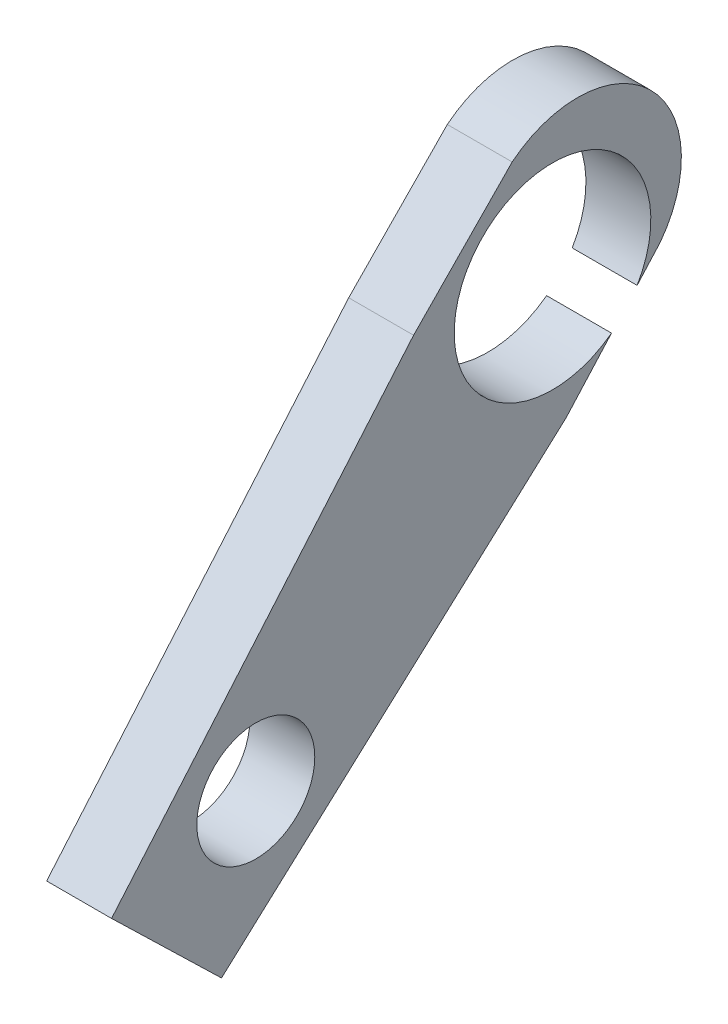
from build123d import *

# Parameters (mm, degrees)
SKETCH1_R           = 13.372971861
BOSS_EXTRUDE1_DEPTH = 14.713458


with BuildPart() as part:
    # Sketch1 → Boss-Extrude1 (new body)
    with BuildSketch(Plane(origin=(0, 0, 0), x_dir=(0, 0, -1), z_dir=(1, 0, 0))):
        with BuildLine():
            Line((-107.077256, 335.05775), (-175.56099, 254.780796))
            Line((-175.56099, 254.780796), (-150.631652, 230.622856))
            Line((-150.631652, 230.622856), (-72.502522, 301.552356))
            Line((-72.502522, 301.552356), (-62.201011559, 313.03589653))
            ThreePointArc((-62.201011559, 313.03589653), (-95.515627855, 340.840078742), (-53.283651357, 330.870306))
            ThreePointArc((-53.283651357, 330.870306), (-54.076724145, 324.9770363), (-56.399514867, 319.50307654))
            Line((-56.399514867, 319.50307654), (-51.143154, 325.36257))
            ThreePointArc((-51.143154, 325.36257), (-53.524433804, 356.502187085), (-84.723478, 357.904288))
            Line((-84.723478, 357.904288), (-107.077256, 335.05775))
        make_face()
        with Locations((-142.853156, 263.47039)):
            Circle(SKETCH1_R, mode=Mode.SUBTRACT)
    extrude(amount=BOSS_EXTRUDE1_DEPTH)


solid = part.part
